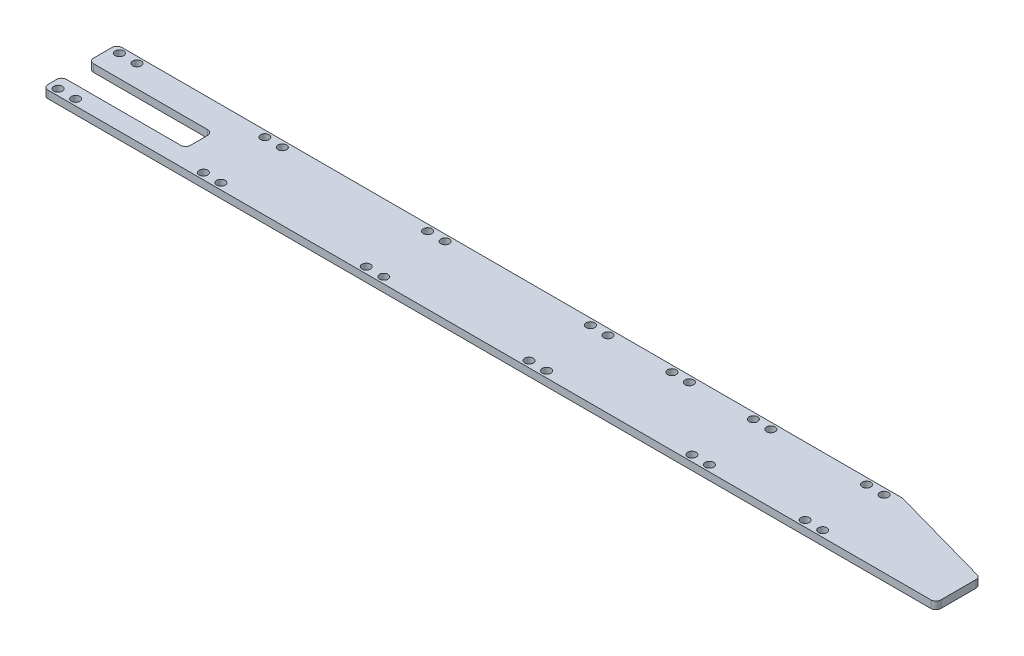
from build123d import *

# Parameters (mm, degrees)
BOSS_EXTRUDE1_DEPTH     = 3
M3_CLEARANCE_HOLE1_D    = 3.4
BOSS_EXTRUDE3_START     = -3
SKETCH31_R              = 1.7
BOSS_EXTRUDE3_DEPTH     = 3
CUT_EXTRUDE5_DEPTH      = 10
CUT_EXTRUDE6_DEPTH      = 227.875050806
CUT_EXTRUDE6_DEPTH_BACK = 227.875050806
SKETCH32_R              = 1.7
SKETCH32_W              = 8
SKETCH32_H              = 29.5
FILLET4_R               = 2


with BuildPart() as part:
    # Sketch1 → Boss-Extrude1 (new body)
    with BuildSketch(Plane(origin=(0, 0, 0), x_dir=(1, 0, 0), z_dir=(0, 1, 0))):
        with BuildLine():
            Line((-135.5, 14.75), (135.5, 14.75))
            ThreePointArc((135.5, 14.75), (137.267766953, 14.017766953), (138, 12.25))
            Line((138, 12.25), (138, -12.25))
            ThreePointArc((138, -12.25), (137.267766953, -14.017766953), (135.5, -14.75))
            Line((135.5, -14.75), (-135.5, -14.75))
            ThreePointArc((-135.5, -14.75), (-137.267766953, -14.017766953), (-138, -12.25))
            Line((-138, -12.25), (-138, 12.25))
            ThreePointArc((-138, 12.25), (-137.267766953, 14.017766953), (-135.5, 14.75))
        make_face()
    extrude(amount=BOSS_EXTRUDE1_DEPTH)

    # M3 Clearance Hole1 (through all)
    with Locations(Plane.XZ):
        with Locations((-133.5, 12.25), (-126.5, 12.25), (-133.5, -12.25), (-126.5, -12.25), (-68.5, 12.25), (-61.5, 12.25), (-68.5, -12.25), (-61.5, -12.25), (-3.5, 12.25), (3.5, 12.25), (-3.5, -12.25), (3.5, -12.25), (61.5, 12.25), (68.5, 12.25), (61.5, -12.25), (68.5, -12.25), (126.5, 12.25), (133.5, 12.25), (126.5, -12.25), (133.5, -12.25), (94, -12.25), (101, -12.25)):
            Hole(M3_CLEARANCE_HOLE1_D / 2)

    # Sketch31 → Boss-Extrude3 (add)
    with BuildSketch(Plane(origin=(0, 3, 0), x_dir=(1, 0, 0), z_dir=(0, 1, 0)).offset(BOSS_EXTRUDE3_START)):
        with BuildLine():
            Line((135.5, 14.75), (183.187594482, 14.75))
            ThreePointArc((183.187594482, 14.75), (183.527894438, 14.726730898), (183.861859615, 14.657356752))
            Line((183.861859615, 14.657356752), (224.91460107, 3.159089135))
            ThreePointArc((224.91460107, 3.159089135), (225.968742259, 2.441751578), (226.375188963, 1.233203733))
            Line((226.375188963, 1.233203733), (226.375188963, -12.75))
            ThreePointArc((226.375188963, -12.75), (225.789402526, -14.164213562), (224.375188963, -14.75))
            Line((224.375188963, -14.75), (135.5, -14.75))
            ThreePointArc((135.5, -14.75), (137.267766953, -14.017766953), (138, -12.25))
            Line((138, -12.25), (138, 12.25))
            ThreePointArc((138, 12.25), (137.267766953, 14.017766953), (135.5, 14.75))
        make_face()
        with Locations(Location((171.687594482, 12.25, 0), (0, 0, 270))):
            Circle(SKETCH31_R, mode=Mode.SUBTRACT)
        with Locations(Location((178.687594482, 12.25, 0), (0, 0, 270))):
            Circle(SKETCH31_R, mode=Mode.SUBTRACT)
        with Locations(Location((178.687594482, -12.25, 0), (0, 0, 90))):
            Circle(SKETCH31_R, mode=Mode.SUBTRACT)
        with Locations(Location((171.687594482, -12.25, 0), (0, 0, 90))):
            Circle(SKETCH31_R, mode=Mode.SUBTRACT)
    extrude(amount=BOSS_EXTRUDE3_DEPTH)

    # Sketch29 → Cut-Extrude5 (cut)
    with BuildSketch(Plane.XZ):
        with BuildLine():
            Line((-80.5, 5.3456), (-80.5, -1.4522))
            ThreePointArc((-80.5, -1.4522), (-81.085786438, -2.866413562), (-82.5, -3.4522))
            Line((-82.5, -3.4522), (-138, -3.4522))
            Line((-138, -3.4522), (-138, 9.8456))
            ThreePointArc((-138, 9.8456), (-137.267766953, 8.077833047), (-135.5, 7.3456))
            Line((-135.5, 7.3456), (-82.5, 7.3456))
            ThreePointArc((-82.5, 7.3456), (-81.085786438, 6.759813562), (-80.5, 5.3456))
        make_face()
    extrude(amount=-CUT_EXTRUDE5_DEPTH, mode=Mode.SUBTRACT)

    # Sketch32 → Cut-Extrude6 (cut, two sides: drawn at the far end of the back side and taken through both)
    with BuildSketch(Plane(origin=(0, 0, 0), x_dir=(1, 0, 0), z_dir=(0, 1, 0)).offset(-CUT_EXTRUDE6_DEPTH_BACK)):
        with Locations(Location((-119.5, 12.25, 0), (0, 0, 270))):
            Circle(SKETCH32_R)
        with Locations(Location((-119.5, -12.25, 0), (0, 0, 270))):
            Circle(SKETCH32_R)
        with Locations((-134, 0)):
            Rectangle(SKETCH32_W, SKETCH32_H)
    extrude(amount=CUT_EXTRUDE6_DEPTH + CUT_EXTRUDE6_DEPTH_BACK, mode=Mode.SUBTRACT)

    # Fillet4
    fillet4_edges = [part.edges().sort_by_distance(p)[0] for p in [
        (-130, 1.5, -3.4522),
        (-130, 1.5, 14.75),
        (-130, 1.5, 7.3456),
        (-130, 1.5, -14.75),
    ]]
    fillet(fillet4_edges, radius=FILLET4_R)


solid = part.part
